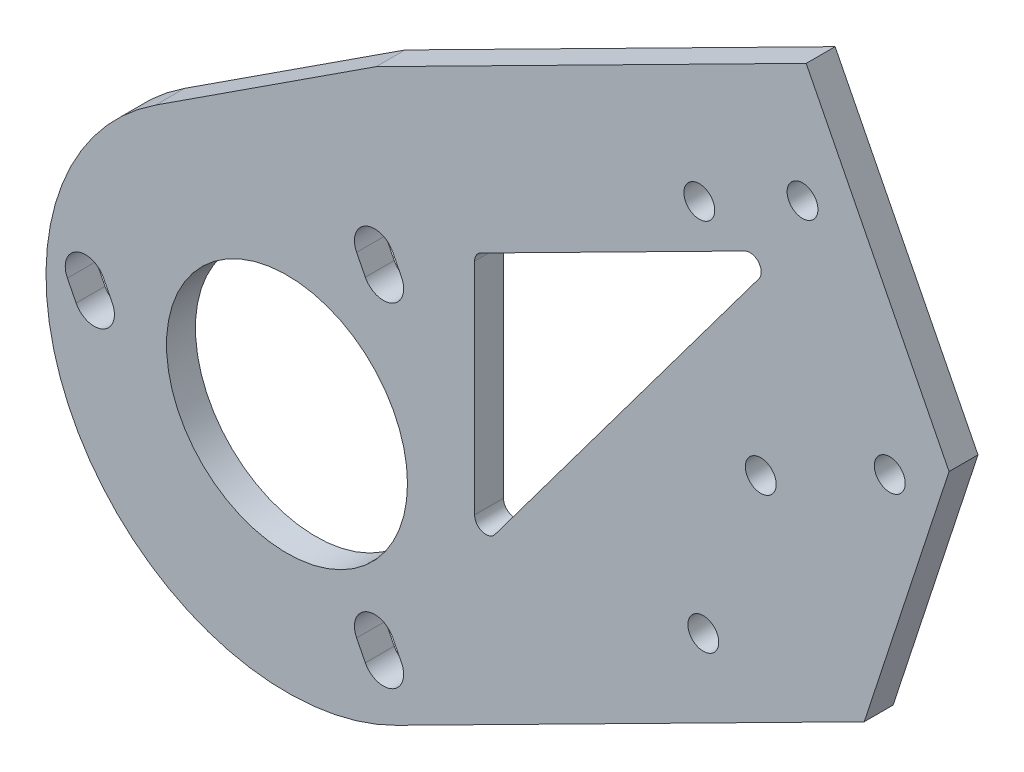
from build123d import *

# Parameters (mm, degrees)
SKETCH1_R          = 12.5
SKETCH1_R_2        = 1.6
EXTRUDE1_DEPTH     = 3
CHAMFER1_SIZE      = 20
SKETCH2_R          = 1.6
CUT_EXTRUDE1_DEPTH = 3
CUT_EXTRUDE3_DEPTH = 3


with BuildPart() as part:
    # Sketch1 → Extrude1 (new body)
    with BuildSketch(Plane.XY):
        with BuildLine():
            Line((77.718550226, 11.3466222), (53.857627652, 58.447539112))
            Line((53.857627652, 58.447539112), (9.254486637, 35.851968493))
            Line((9.254486637, 35.851968493), (-13.637193397, 20.952970106))
            ThreePointArc((-13.637193397, 20.952970106), (-21.658878744, -12.485710694), (11.29778531, -22.301570507))
            Line((11.29778531, -22.301570507), (77.718550226, 11.3466222))
        make_face()
        Circle(SKETCH1_R, mode=Mode.SUBTRACT)
        with Locations((53.476276267, 45.923379615)):
            Circle(SKETCH1_R_2, mode=Mode.SUBTRACT)
        with Locations((42.771522423, 40.500442666)):
            Circle(SKETCH1_R_2, mode=Mode.SUBTRACT)
        with BuildLine():
            Line((8.126668077, 16.37149411), (7.222845253, 18.15561975))
            ThreePointArc((7.222845253, 18.15561975), (8.147163209, 20.977965639), (10.969509098, 20.053647682))
            Line((10.969509098, 20.053647682), (11.873331923, 18.269522042))
            ThreePointArc((11.873331923, 18.269522042), (10.949013966, 15.447176153), (8.126668077, 16.37149411))
        make_face(mode=Mode.SUBTRACT)
        with BuildLine():
            Line((-21.873331923, -0.949013966), (-22.777154747, 0.835111675))
            ThreePointArc((-22.777154747, 0.835111675), (-21.852836791, 3.657457563), (-19.030490902, 2.733139607))
            Line((-19.030490902, 2.733139607), (-18.126668077, 0.949013966))
            ThreePointArc((-18.126668077, 0.949013966), (-19.050986034, -1.873331923), (-21.873331923, -0.949013966))
        make_face(mode=Mode.SUBTRACT)
        with BuildLine():
            Line((8.126668077, -18.269522042), (7.222845253, -16.485396401))
            ThreePointArc((7.222845253, -16.485396401), (8.147163209, -13.663050512), (10.969509098, -14.587368469))
            Line((10.969509098, -14.587368469), (11.873331923, -16.37149411))
            ThreePointArc((11.873331923, -16.37149411), (10.949013966, -19.193839998), (8.126668077, -18.269522042))
        make_face(mode=Mode.SUBTRACT)
    extrude(amount=EXTRUDE1_DEPTH)

    # Chamfer1
    chamfer1_edges = [part.edges().sort_by_distance(p)[0] for p in [
        (77.718550226, 11.3466222, 1.5),
    ]]
    chamfer(chamfer1_edges, length=CHAMFER1_SIZE)

    # Sketch2 → Cut-Extrude1 (cut)
    with BuildSketch(Plane.XY.offset(3)):
        with Locations((62.526264519, 25.846086156)):
            Circle(SKETCH2_R)
        with Locations((49.145322214, 19.06741497)):
            Circle(SKETCH2_R)
        with Locations((43.188041489, 1.899305514)):
            Circle(SKETCH2_R)
    extrude(amount=-CUT_EXTRUDE1_DEPTH, mode=Mode.SUBTRACT)

    # Sketch4 → Cut-Extrude3 (cut)
    with BuildSketch(Plane.XY.offset(3)):
        with BuildLine():
            Line((20.102322982, 24.532430534), (47.488856964, 38.406214947))
            ThreePointArc((47.488856964, 38.406214947), (48.918221015, 38.11442299), (48.960317371, 36.656187058))
            Line((48.960317371, 36.656187058), (21.573783389, -0.017867108))
            ThreePointArc((21.573783389, -0.017867108), (20.262801724, -0.42963276), (19.458756207, 0.684698738))
            Line((19.458756207, 0.684698738), (19.458756207, 23.48496849))
            ThreePointArc((19.458756207, 23.48496849), (19.63250249, 24.099654371), (20.102322982, 24.532430534))
        make_face()
    extrude(amount=-CUT_EXTRUDE3_DEPTH, mode=Mode.SUBTRACT)


solid = part.part
